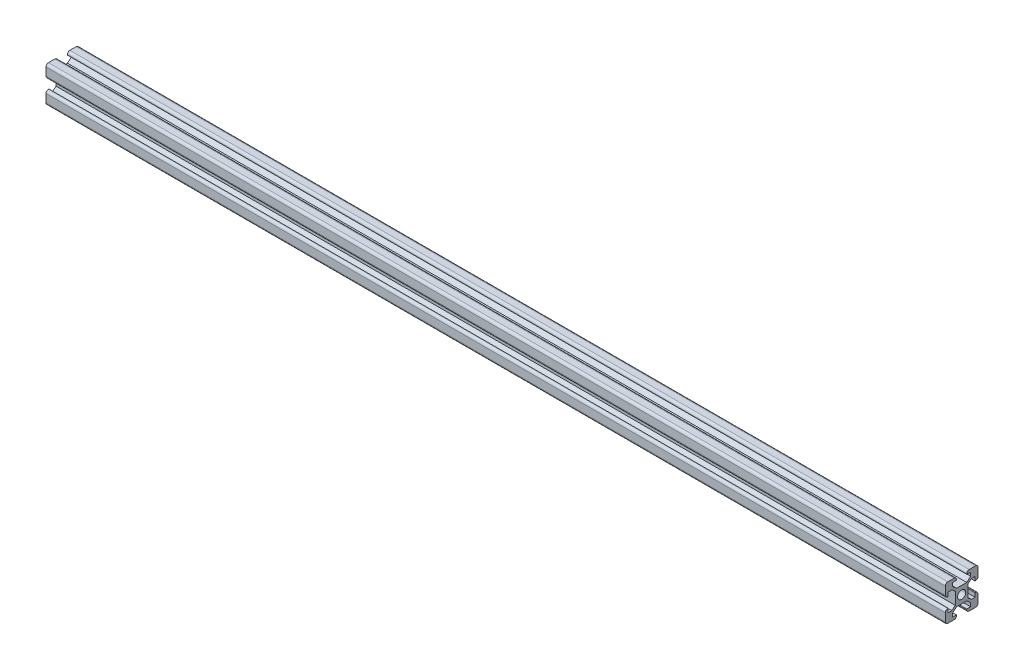
from build123d import *

# Parameters (mm, degrees)
SKETCH1_R           = 2.5
BOSS_EXTRUDE1_DEPTH = 550


with BuildPart() as part:
    # Sketch1 → Boss-Extrude1 (new body)
    with BuildSketch(Plane(origin=(0, 0, 0), x_dir=(0, 0, -1), z_dir=(1, 0, 0))):
        with BuildLine():
            Line((-3.1, 4.9), (-5.5, 6.954100836))
            Line((-5.5, 6.954100836), (-5.5, 9.2))
            Line((-5.5, 9.2), (-3.1, 9.2))
            Line((-3.1, 9.2), (-3.1, 9.5))
            ThreePointArc((-3.1, 9.5), (-3.539339828, 10.560660172), (-4.6, 11))
            Line((-4.6, 11), (-8.5, 11))
            ThreePointArc((-8.5, 11), (-9.560660172, 10.560660172), (-10, 9.5))
            Line((-10, 9.5), (-10, 4.6))
            ThreePointArc((-10, 4.6), (-9.560660172, 3.539339828), (-8.5, 3.1))
            Line((-8.5, 3.1), (-8.2, 3.1))
            Line((-8.2, 3.1), (-8.2, 5.5))
            Line((-8.2, 5.5), (-5.954100836, 5.5))
            Line((-5.954100836, 5.5), (-3.9, 3.741945732))
            Line((-3.9, 3.741945732), (-3.9, -3.741945732))
            Line((-3.9, -3.741945732), (-5.954100836, -5.5))
            Line((-5.954100836, -5.5), (-8.2, -5.5))
            Line((-8.2, -5.5), (-8.2, -3.1))
            Line((-8.2, -3.1), (-8.5, -3.1))
            ThreePointArc((-8.5, -3.1), (-9.560660172, -3.539339828), (-10, -4.6))
            Line((-10, -4.6), (-10, -9.5))
            ThreePointArc((-10, -9.5), (-9.560660172, -10.560660172), (-8.5, -11))
            Line((-8.5, -11), (-4.6, -11))
            ThreePointArc((-4.6, -11), (-3.539339828, -10.560660172), (-3.1, -9.5))
            Line((-3.1, -9.5), (-3.1, -9.2))
            Line((-3.1, -9.2), (-5.5, -9.2))
            Line((-5.5, -9.2), (-5.5, -6.954100836))
            Line((-5.5, -6.954100836), (-3.1, -4.9))
            Line((-3.1, -4.9), (3.1, -4.9))
            Line((3.1, -4.9), (5.5, -6.954100836))
            Line((5.5, -6.954100836), (5.5, -9.2))
            Line((5.5, -9.2), (3.1, -9.2))
            Line((3.1, -9.2), (3.1, -9.5))
            ThreePointArc((3.1, -9.5), (3.539339828, -10.560660172), (4.6, -11))
            Line((4.6, -11), (8.5, -11))
            ThreePointArc((8.5, -11), (9.560660172, -10.560660172), (10, -9.5))
            Line((10, -9.5), (10, -4.6))
            ThreePointArc((10, -4.6), (9.560660172, -3.539339828), (8.5, -3.1))
            Line((8.5, -3.1), (8.2, -3.1))
            Line((8.2, -3.1), (8.2, -5.5))
            Line((8.2, -5.5), (5.954100836, -5.5))
            Line((5.954100836, -5.5), (3.9, -3.741945732))
            Line((3.9, -3.741945732), (3.9, 3.741945732))
            Line((3.9, 3.741945732), (5.954100836, 5.5))
            Line((5.954100836, 5.5), (8.2, 5.5))
            Line((8.2, 5.5), (8.2, 3.1))
            Line((8.2, 3.1), (8.5, 3.1))
            ThreePointArc((8.5, 3.1), (9.560660172, 3.539339828), (10, 4.6))
            Line((10, 4.6), (10, 9.5))
            ThreePointArc((10, 9.5), (9.560660172, 10.560660172), (8.5, 11))
            Line((8.5, 11), (4.6, 11))
            ThreePointArc((4.6, 11), (3.539339828, 10.560660172), (3.1, 9.5))
            Line((3.1, 9.5), (3.1, 9.2))
            Line((3.1, 9.2), (5.5, 9.2))
            Line((5.5, 9.2), (5.5, 6.954100836))
            Line((5.5, 6.954100836), (3.1, 4.9))
            Line((3.1, 4.9), (-3.1, 4.9))
        make_face()
        Circle(SKETCH1_R, mode=Mode.SUBTRACT)
    extrude(amount=BOSS_EXTRUDE1_DEPTH)


solid = part.part
